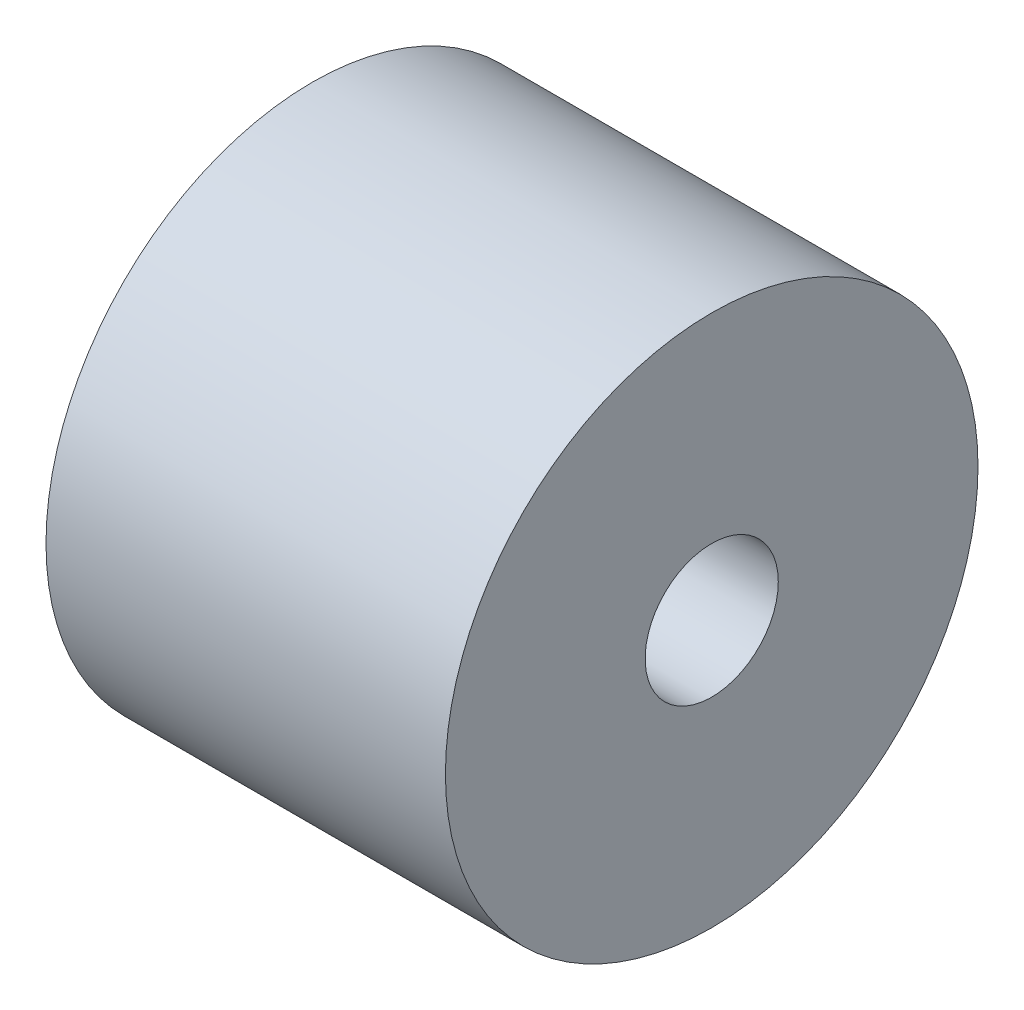
from build123d import *

# Parameters (mm, degrees)
ESBO_O1_R                = 2
ESBO_O1_R_2              = 0.5
RESSALTO_EXTRUS_O1_DEPTH = 3


with BuildPart() as part:
    # Esboço1 → Ressalto-extrusão1 (new body)
    with BuildSketch(Plane(origin=(0, 0, 0), x_dir=(0, 0, -1), z_dir=(1, 0, 0))):
        Circle(ESBO_O1_R)
        Circle(ESBO_O1_R_2, mode=Mode.SUBTRACT)
    extrude(amount=RESSALTO_EXTRUS_O1_DEPTH)


solid = part.part
